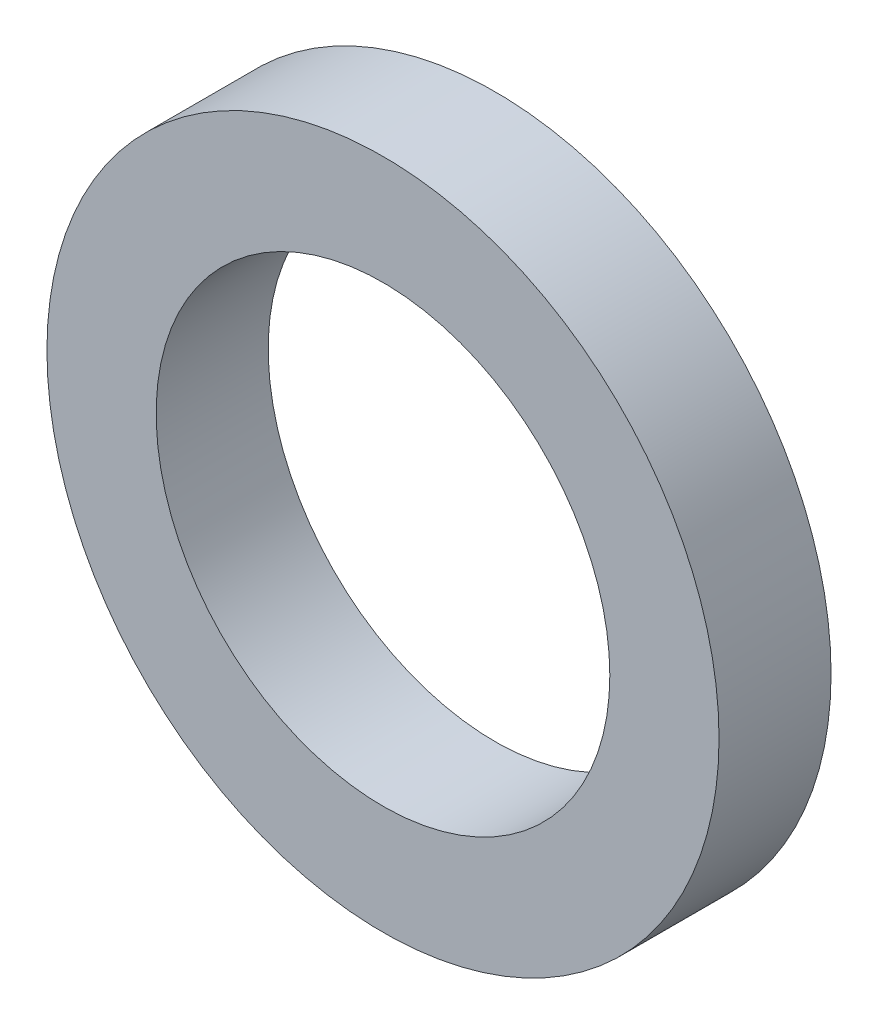
from build123d import *

# Parameters (mm, degrees)
PROFILE_1_R   = 6
PROFILE_1_R_2 = 4.05
RING_DEPTH    = 2


with BuildPart() as part:
    # Profile_1 → Ring (new body)
    with BuildSketch(Plane.XY):
        Circle(PROFILE_1_R)
        Circle(PROFILE_1_R_2, mode=Mode.SUBTRACT)
    extrude(amount=RING_DEPTH)


solid = part.part
